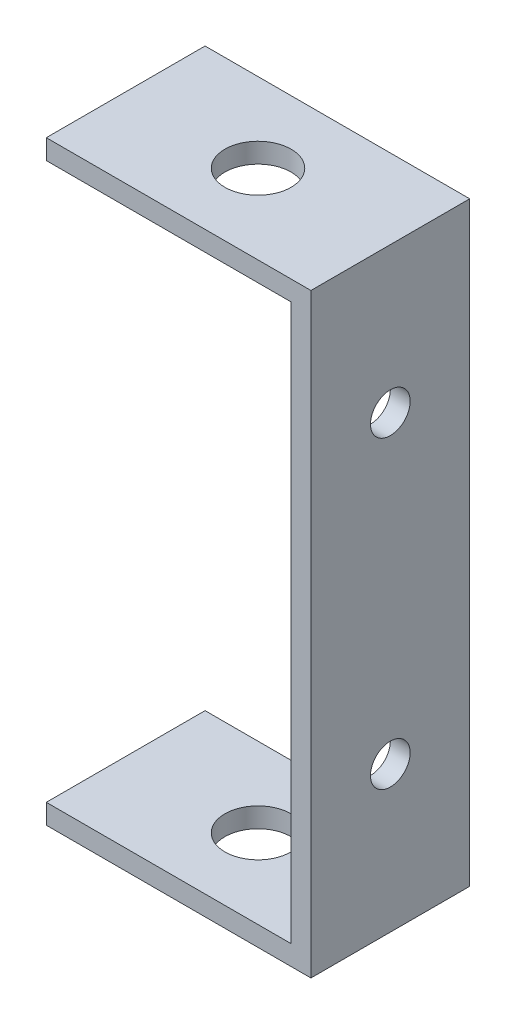
from build123d import *

# Parameters (mm, degrees)
SKETCH1_W           = 18.5
SKETCH1_H           = 12
BOSS_EXTRUDE1_DEPTH = 1.5
SKETCH1_3_W         = 1.5
SKETCH1_3_H         = 12
BOSS_EXTRUDE2_DEPTH = 45
SKETCH2_R           = 1.5
CUT_EXTRUDE1_DEPTH  = 50.608467019
BOSS_EXTRUDE3_START = -45
SKETCH1_4_W         = 18.5
SKETCH1_4_H         = 12
BOSS_EXTRUDE3_DEPTH = 1.5
SKETCH3_R           = 2.5
CUT_EXTRUDE2_DEPTH  = 47.486557197


with BuildPart() as part:
    # Sketch1 → Boss-Extrude1 (new body)
    with BuildSketch(Plane(origin=(0, 0, 0), x_dir=(1, 0, 0), z_dir=(0, 1, 0))):
        with Locations((-0.75, 0)):
            Rectangle(SKETCH1_W, SKETCH1_H)
    extrude(amount=-BOSS_EXTRUDE1_DEPTH)

    # Sketch1<3> → Boss-Extrude2 (add)
    with BuildSketch(Plane(origin=(0, 0, 0), x_dir=(1, 0, 0), z_dir=(0, 1, 0))):
        with Locations((9.25, 0)):
            Rectangle(SKETCH1_3_W, SKETCH1_3_H)
    extrude(amount=-BOSS_EXTRUDE2_DEPTH)

    # Sketch2 → Cut-Extrude1 (cut, through all)
    with BuildSketch(Plane(origin=(10, 0, 0), x_dir=(0, 0, -1), z_dir=(1, 0, 0))):
        with Locations((0, -34)):
            Circle(SKETCH2_R)
        with Locations((0, -11)):
            Circle(SKETCH2_R)
    extrude(amount=-CUT_EXTRUDE1_DEPTH, mode=Mode.SUBTRACT)

    # Sketch1<4> → Boss-Extrude3 (add)
    with BuildSketch(Plane(origin=(0, 0, 0), x_dir=(1, 0, 0), z_dir=(0, 1, 0)).offset(BOSS_EXTRUDE3_START)):
        with Locations((-0.75, 0)):
            Rectangle(SKETCH1_4_W, SKETCH1_4_H)
    extrude(amount=BOSS_EXTRUDE3_DEPTH)

    # Sketch3 → Cut-Extrude2 (cut, through all)
    with BuildSketch(Plane(origin=(0, 0, 0), x_dir=(1, 0, 0), z_dir=(0, 1, 0))):
        with Locations(Location((0, 0, 0), (0, 0, 270))):
            Circle(SKETCH3_R)
    extrude(amount=-CUT_EXTRUDE2_DEPTH, mode=Mode.SUBTRACT)


solid = part.part
